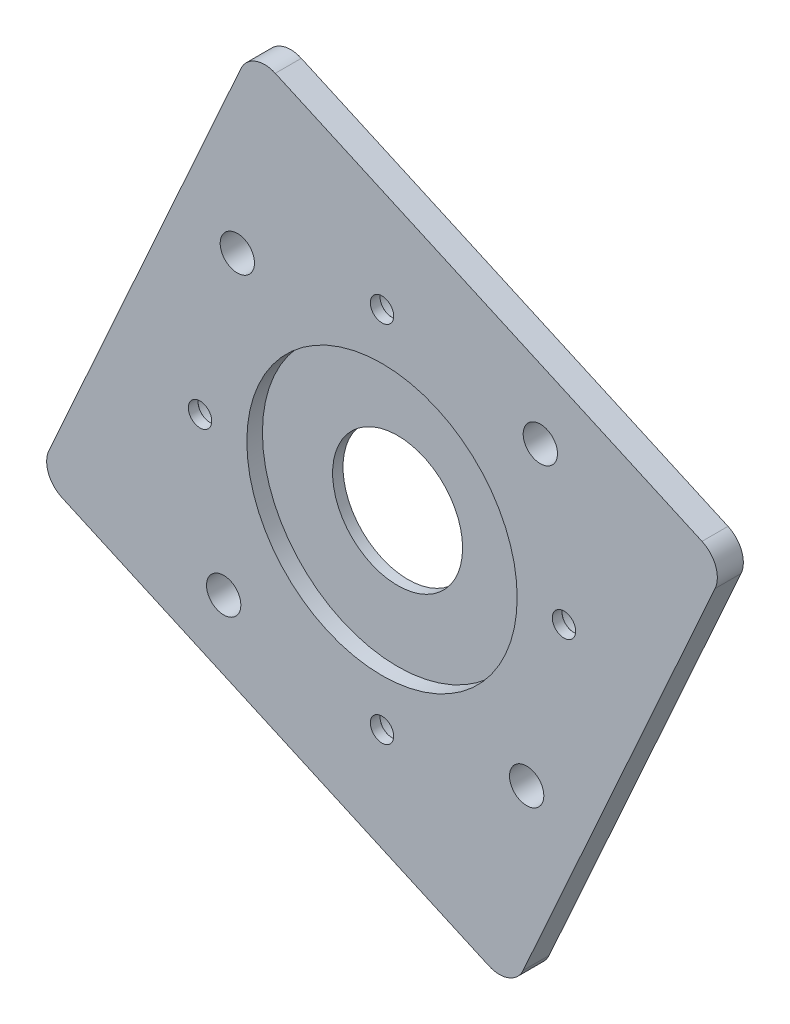
from build123d import *

# Parameters (mm, degrees)
ESQUISSE1_R                                = 50
BOSS_EXTRU_1_DEPTH                         = 5
ESQUISSE2_R                                = 26
ENL_V_MAT_EXTRU_1_DEPTH                    = 3
ESQUISSE3_R                                = 12.5
ENL_V_MAT_EXTRU_2_DEPTH                    = 71.887234394
CHAMBRAGE_POUR_VIS_T_TE_RONDE_BOMB_2_COUNT = 2
CHAMBRAGE_POUR_VIS_T_TE_RONDE_BOMB_2_PITCH = 49.497474683
CHAMBRAGE_POUR_VIS_T_TE_RONDE_BOMB_3_COUNT = 2
CHAMBRAGE_POUR_VIS_T_TE_RONDE_BOMB_3_PITCH = 70
CHAMBRAGE_POUR_VIS_T_TE_RONDE_BOMB_4_COUNT = 2
CHAMBRAGE_POUR_VIS_T_TE_RONDE_BOMB_4_PITCH = 49.497474683
D_GAGEMENT_M62_D                           = 6.6
BOSS_EXTRU_3_DEPTH                         = 5


with BuildPart() as part:
    # Esquisse1 → Boss.-Extru.1 (new body)
    with BuildSketch(Plane.XY):
        Circle(ESQUISSE1_R)
    extrude(amount=BOSS_EXTRU_1_DEPTH)

    # Esquisse2 → Enlèv. mat.-Extru.1 (cut)
    with BuildSketch(Plane.XY.offset(5)):
        Circle(ESQUISSE2_R)
    extrude(amount=-ENL_V_MAT_EXTRU_1_DEPTH, mode=Mode.SUBTRACT)

    # Esquisse3 → Enlèv. mat.-Extru.2 (cut, through all)
    with BuildSketch(Plane.XY.offset(5)):
        Circle(ESQUISSE3_R)
    extrude(amount=-ENL_V_MAT_EXTRU_2_DEPTH, mode=Mode.SUBTRACT)

    # Esquisse5 → Chambrage pour vis à tête ronde bombée M41 (revolve, cut)
    with BuildSketch(Plane(origin=(0, 35, 0), x_dir=(0, 1, 0), z_dir=(1, 0, 0))):
        Polygon((0, 0), (0, 5), (2.25, 5), (2.25, 3.125), (2.275, 3.1), (4.5, 3.1), (4.5, 0), align=None)
    chambrage_pour_vis_t_te_ronde_bomb_e_m = revolve(axis=Axis((0, 35, -6.35), (0, 0, 1)), mode=Mode.SUBTRACT)

    # Chambrage pour vis _ t_te ronde bomb 2: Chambrage pour vis à tête ronde bombée M41 ×2
    with Locations(*[Vector(-0.7071067811865476, -0.7071067811865476, 0) * (i * CHAMBRAGE_POUR_VIS_T_TE_RONDE_BOMB_2_PITCH) for i in range(1, CHAMBRAGE_POUR_VIS_T_TE_RONDE_BOMB_2_COUNT)]):
        add(chambrage_pour_vis_t_te_ronde_bomb_e_m, mode=Mode.SUBTRACT)

    # Chambrage pour vis _ t_te ronde bomb 3: Chambrage pour vis à tête ronde bombée M41 ×2
    with Locations(*[(0, -i * CHAMBRAGE_POUR_VIS_T_TE_RONDE_BOMB_3_PITCH, 0) for i in range(1, CHAMBRAGE_POUR_VIS_T_TE_RONDE_BOMB_3_COUNT)]):
        add(chambrage_pour_vis_t_te_ronde_bomb_e_m, mode=Mode.SUBTRACT)

    # Chambrage pour vis _ t_te ronde bomb 4: Chambrage pour vis à tête ronde bombée M41 ×2
    with Locations(*[Vector(0.7071067811865476, -0.7071067811865476, 0) * (i * CHAMBRAGE_POUR_VIS_T_TE_RONDE_BOMB_4_PITCH) for i in range(1, CHAMBRAGE_POUR_VIS_T_TE_RONDE_BOMB_4_COUNT)]):
        add(chambrage_pour_vis_t_te_ronde_bomb_e_m, mode=Mode.SUBTRACT)

    # Dégagement M62 (through all)
    with Locations(Plane.XY.offset(5)):
        with Locations((30.452660491, 27.824413184), (-27.824413184, 30.452660491), (-30.452660491, -27.824413184), (27.824413184, -30.452660491)):
            Hole(D_GAGEMENT_M62_D / 2)

    # Esquisse12 → Boss.-Extru.3 (add)
    with BuildSketch(Plane(origin=(0, 0, 0), x_dir=(-1, 0, 0), z_dir=(0, 0, -1))):
        with BuildLine():
            ThreePointArc((-61.551276684, 27.137434265), (-64.174792612, 24.35142904), (-64.059895327, 20.526319949))
            Line((-64.059895327, 20.526319949), (-45.598664842, -20.512478267))
            ThreePointArc((-45.598664842, -20.512478267), (-46.747637649, 17.738612524), (-20.512478495, 45.598664739))
            Line((-20.512478495, 45.598664739), (-61.551276684, 27.137434265))
        make_face()
        with BuildLine():
            ThreePointArc((20.51247781, -45.598665047), (-17.738612875, -46.747637515), (-45.598664842, -20.512478267))
            Line((-45.598664842, -20.512478267), (-27.137434265, -61.551276684))
            ThreePointArc((-27.137434265, -61.551276684), (-24.35142904, -64.174792612), (-20.526319949, -64.059895327))
            Line((-20.526319949, -64.059895327), (20.51247781, -45.598665047))
        make_face()
        with BuildLine():
            Line((20.526319949, 64.059895327), (-20.512478495, 45.598664739))
            ThreePointArc((-20.512478495, 45.598664739), (17.738612852, 46.747637524), (45.598665129, 20.512477628))
            Line((45.598665129, 20.512477628), (27.137434265, 61.551276684))
            ThreePointArc((27.137434265, 61.551276684), (24.35142904, 64.174792612), (20.526319949, 64.059895327))
        make_face()
        with BuildLine():
            ThreePointArc((45.598665129, 20.512477628), (46.747637391, -17.738613203), (20.51247781, -45.598665047))
            Line((20.51247781, -45.598665047), (61.551276684, -27.137434265))
            ThreePointArc((61.551276684, -27.137434265), (64.174792612, -24.35142904), (64.059895327, -20.526319949))
            Line((64.059895327, -20.526319949), (45.598665129, 20.512477628))
        make_face()
    extrude(amount=-BOSS_EXTRU_3_DEPTH)


solid = part.part
